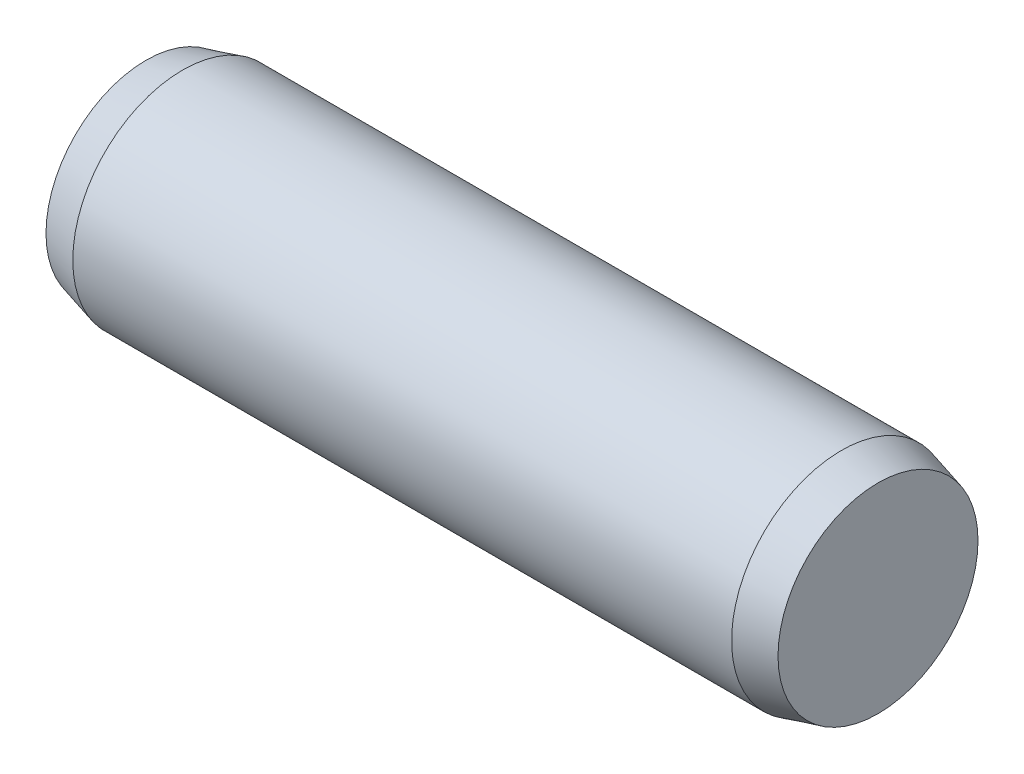
from build123d import *

# Parameters (mm, degrees)
EXTRUDE1_DEPTH      = 4.5
EXTRUDE1_DEPTH_BACK = 4.5
SKETCH2_R           = 1.5
SKETCH3_R           = 1.5
EXTRUDE2_DEPTH      = 0.5
EXTRUDE2_TAPER      = 15
SKETCH4_R           = 1.5
EXTRUDE3_DEPTH      = 0.5
EXTRUDE3_TAPER      = 15


with BuildPart() as part:
    # Sketch2 → Extrude1 (new, two sides: drawn at the far end of the back side and taken through both)
    with BuildSketch(Plane(origin=(0, 0, 0), x_dir=(0, 0, -1), z_dir=(1, 0, 0)).offset(-EXTRUDE1_DEPTH_BACK)):
        Circle(SKETCH2_R)
    extrude(amount=EXTRUDE1_DEPTH + EXTRUDE1_DEPTH_BACK)

    # Sketch3 → Extrude2 (add)
    with BuildSketch(Plane(origin=(4.5, 0, 0), x_dir=(0, 0, -1), z_dir=(1, 0, 0))):
        Circle(SKETCH3_R)
    extrude(amount=EXTRUDE2_DEPTH, taper=EXTRUDE2_TAPER)

    # Sketch4 → Extrude3 (add)
    with BuildSketch(Plane.ZY.offset(4.5)):
        with Locations(Location((0, 0, 0), (0, 0, 180))):
            Circle(SKETCH4_R)
    extrude(amount=EXTRUDE3_DEPTH, taper=EXTRUDE3_TAPER)


solid = part.part
